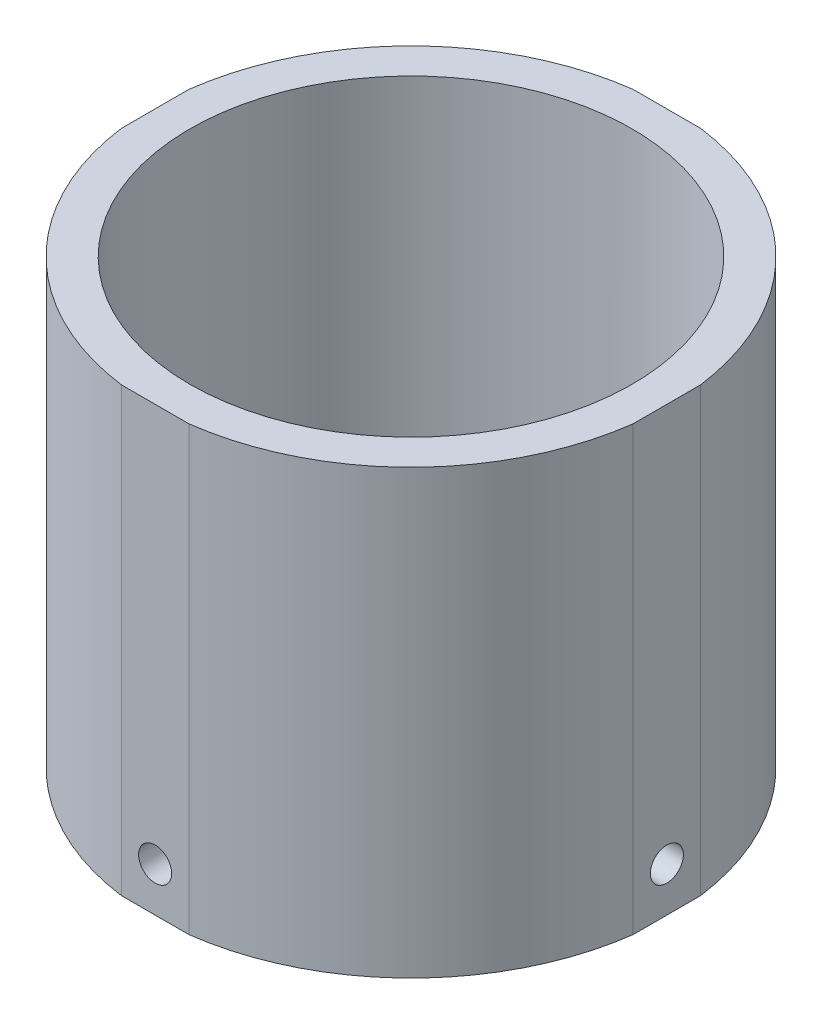
from build123d import *

# Parameters (mm, degrees)
SKETCH1_R               = 22.225
SKETCH1_R_2             = 19.05
BOSS_EXTRUDE1_DEPTH     = 38.1
CUT_EXTRUDE1_DEPTH      = 43.18
CUT_EXTRUDE1_DEPTH_BACK = 43.18
SKETCH2_R               = 1.4224
CUT_EXTRUDE2_DEPTH      = 43.18
CUT_EXTRUDE2_DEPTH_BACK = 43.18
SKETCH3_R               = 1.4224
SKETCH4_W               = 49.025527768
SKETCH4_H               = 48.000320082
SKETCH4_W_2             = 44.069
SKETCH4_H_2             = 44.069
CUT_EXTRUDE3_DEPTH      = 43.18


with BuildPart() as part:
    # Sketch1 → Boss-Extrude1 (new body)
    with BuildSketch(Plane(origin=(0, 0, 0), x_dir=(1, 0, 0), z_dir=(0, 1, 0))):
        Circle(SKETCH1_R)
        Circle(SKETCH1_R_2, mode=Mode.SUBTRACT)
    extrude(amount=BOSS_EXTRUDE1_DEPTH)

    # Sketch2 → Cut-Extrude1 (cut, two sides: drawn at the far end of the back side and taken through both)
    with BuildSketch(Plane.XY.offset(-CUT_EXTRUDE1_DEPTH_BACK)):
        with Locations((0, 3.81)):
            Circle(SKETCH2_R)
    extrude(amount=CUT_EXTRUDE1_DEPTH + CUT_EXTRUDE1_DEPTH_BACK, mode=Mode.SUBTRACT)

    # Sketch3 → Cut-Extrude2 (cut, two sides: drawn at the far end of the back side and taken through both)
    with BuildSketch(Plane(origin=(0, 0, 0), x_dir=(0, 0, -1), z_dir=(1, 0, 0)).offset(-CUT_EXTRUDE2_DEPTH_BACK)):
        with Locations((0, 3.81)):
            Circle(SKETCH3_R)
    extrude(amount=CUT_EXTRUDE2_DEPTH + CUT_EXTRUDE2_DEPTH_BACK, mode=Mode.SUBTRACT)

    # Sketch4 → Cut-Extrude3 (cut)
    with BuildSketch(Plane.XZ):
        Rectangle(SKETCH4_W, SKETCH4_H)
        Rectangle(SKETCH4_W_2, SKETCH4_H_2, mode=Mode.SUBTRACT)
    extrude(amount=-CUT_EXTRUDE3_DEPTH, mode=Mode.SUBTRACT)


solid = part.part
